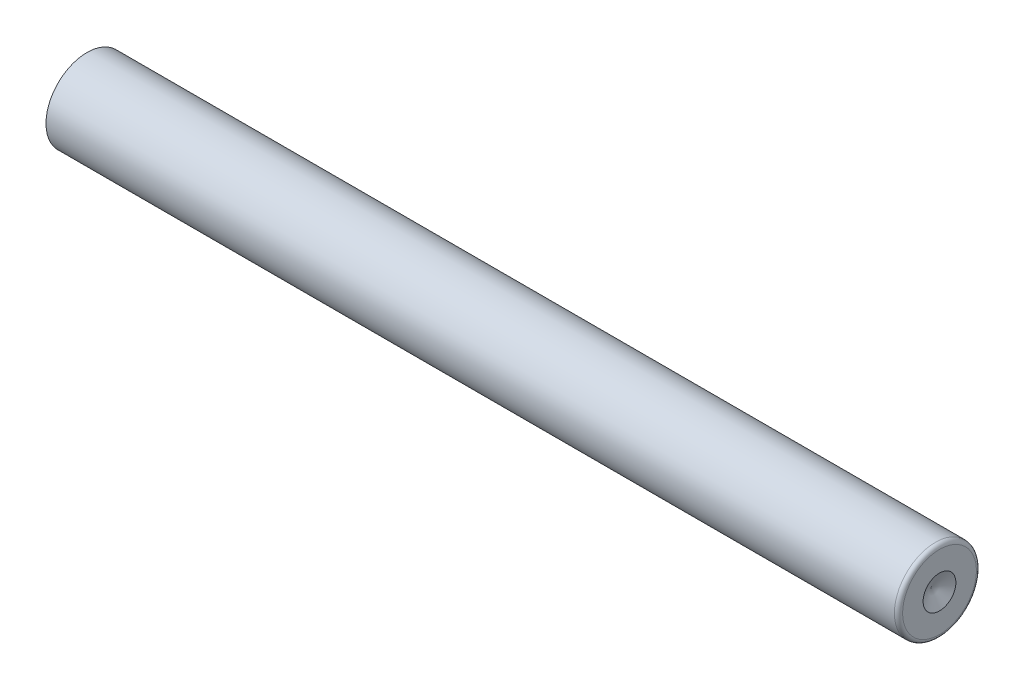
from build123d import *

# Parameters (mm, degrees)
CROQUIS1_W  = 52
CROQUIS1_H  = 2.5
REDONDEO1_R = 0.25


with BuildPart() as part:
    # Croquis1 → Revolución1 (revolve)
    with BuildSketch(Plane.XY, mode=Mode.PRIVATE) as revoluci_n1_sk:
        with Locations((26, 1.25)):
            Rectangle(CROQUIS1_W, CROQUIS1_H)
    revolve(revoluci_n1_sk.sketch.rotate(Axis((0, 0, 0), (1, 0, 0)), 90), axis=Axis((0, 0, 0), (1, 0, 0)))

    # Redondeo1
    redondeo1_edges = [part.edges().sort_by_distance(p)[0] for p in [
        (52, 0, -2.5),
    ]]
    fillet(redondeo1_edges, radius=REDONDEO1_R)

    # Croquis3 → Cortar-Revolución1 (revolve, cut)
    with BuildSketch(Plane.XY):
        Polygon((52, 0), (51.5, 0), (52, 1), align=None)
    revolve(axis=Axis((52, 0, 0), (-1, 0, 0)), mode=Mode.SUBTRACT)


solid = part.part
